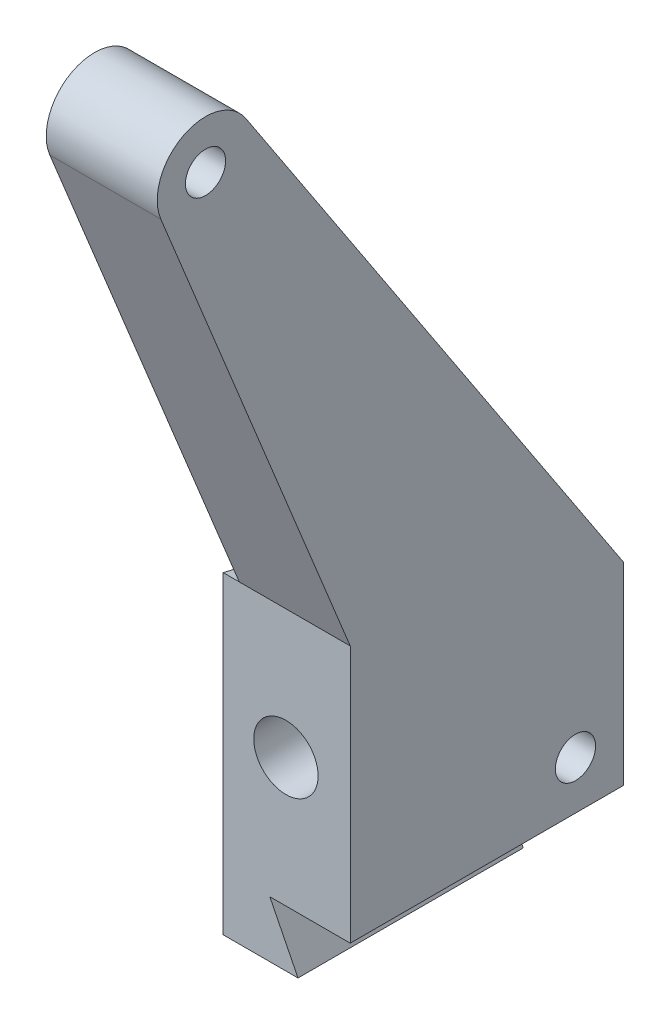
from build123d import *

# Parameters (mm, degrees)
SKETCH1_R             = 1.25
BOSS_EXTRUDE1_DEPTH   = 7.9
CUT_EXTRUDE2_DEPTH    = 61.929549481
M3X0_5_TAPPED_HOLE1_D = 2.5
SKETCH7_W             = 8
SKETCH7_H             = 0.5
CUT_EXTRUDE3_DEPTH    = 61.929549481
SKETCH8_R             = 2
CUT_EXTRUDE4_DEPTH    = 57.217523958
CUT_EXTRUDE5_DEPTH    = 3
CUT_EXTRUDE6_DEPTH    = 1


with BuildPart() as part:
    # Sketch1 → Boss-Extrude1 (new body)
    with BuildSketch(Plane(origin=(0, 0, 0), x_dir=(0, 0, -1), z_dir=(1, 0, 0))):
        with BuildLine():
            Line((0, 0), (0, 16))
            Line((0, 16), (-23.49505807, 51.650837947))
            ThreePointArc((-23.49505807, 51.650837947), (-27.398738146, 52.653965259), (-28.777698581, 48.866690426))
            Line((-28.777698581, 48.866690426), (-17, 20))
            Line((-17, 20), (-17, 0))
            Line((-17, 0), (0, 0))
        make_face()
        with Locations((-26, 50)):
            Circle(SKETCH1_R, mode=Mode.SUBTRACT)
    extrude(amount=BOSS_EXTRUDE1_DEPTH)

    # Sketch3 → Cut-Extrude2 (cut, through all)
    with BuildSketch(Plane(origin=(0, 0, 0), x_dir=(-1, 0, 0), z_dir=(0, 0, -1))):
        Polygon((-7.9, 0), (-4.9, 0), (-2.9, 4), (-7.9, 4), align=None)
    extrude(amount=-CUT_EXTRUDE2_DEPTH, mode=Mode.SUBTRACT)

    # M3x0.5 Tapped Hole1 (through all)
    with Locations(Plane(origin=(7.9, 7, 3), x_dir=(0, 0, 1), z_dir=(1, 0, 0))):
        with Locations((0, 0)):
            Hole(M3X0_5_TAPPED_HOLE1_D / 2)

    # Sketch7 → Cut-Extrude3 (cut, through all)
    with BuildSketch(Plane(origin=(0, 0, 0), x_dir=(-1, 0, 0), z_dir=(0, 0, -1))):
        with Locations((-4, 0.25)):
            Rectangle(SKETCH7_W, SKETCH7_H)
    extrude(amount=-CUT_EXTRUDE3_DEPTH, mode=Mode.SUBTRACT)

    # Sketch8 → Cut-Extrude4 (cut, through all)
    with BuildSketch(Plane.XY.offset(17)):
        with Locations((3.9, 12)):
            Circle(SKETCH8_R)
    extrude(amount=-CUT_EXTRUDE4_DEPTH, mode=Mode.SUBTRACT)

    # Sketch9 → Cut-Extrude5 (cut)
    with BuildSketch(Plane(origin=(0, 0, 0), x_dir=(-1, 0, 0), z_dir=(0, 0, -1))):
        Polygon((-4.65, 0.5), (-2.9, 4), (0, 4), (0, 0.5), align=None)
    extrude(amount=-CUT_EXTRUDE5_DEPTH, mode=Mode.SUBTRACT)

    # Sketch11 → Cut-Extrude6 (cut)
    with BuildSketch(Plane.ZY):
        with BuildLine():
            Line((0, 16), (17, 20))
            Line((17, 20), (28.777698581, 48.866690426))
            ThreePointArc((28.777698581, 48.866690426), (27.398738146, 52.653965259), (23.49505807, 51.650837947))
            Line((23.49505807, 51.650837947), (0, 16))
        make_face()
    extrude(amount=-CUT_EXTRUDE6_DEPTH, mode=Mode.SUBTRACT)


solid = part.part
